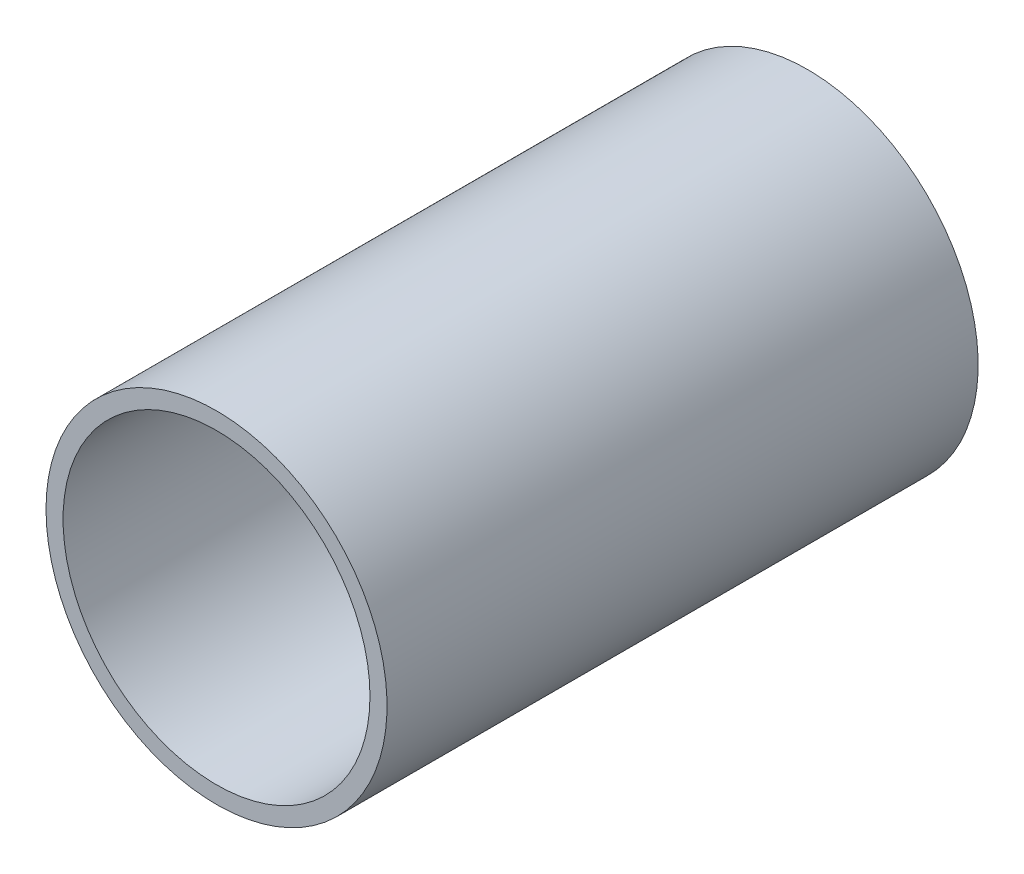
from build123d import *

# Parameters (mm, degrees)
SKETCH1_R           = 15
BOSS_EXTRUDE1_DEPTH = 52
SKETCH2_R           = 13.5
CUT_EXTRUDE1_DEPTH  = 48


with BuildPart() as part:
    # Sketch1 → Boss-Extrude1 (new body)
    with BuildSketch(Plane.XY):
        with Locations(Location((0, 0, 0), (0, 0, 180))):
            Circle(SKETCH1_R)
    extrude(amount=BOSS_EXTRUDE1_DEPTH)

    # Sketch2 → Cut-Extrude1 (cut)
    with BuildSketch(Plane.XY.offset(52)):
        Circle(SKETCH2_R)
    extrude(amount=-CUT_EXTRUDE1_DEPTH, mode=Mode.SUBTRACT)


solid = part.part
